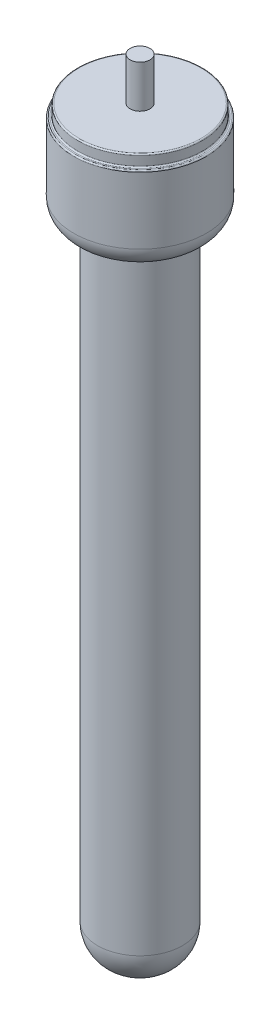
from build123d import *

# Parameters (mm, degrees)
SKETCH1_R           = 12.5
BOSS_EXTRUDE1_DEPTH = 148.5
SKETCH2_OUTSIDE_W   = 57.53
SKETCH2_OUTSIDE_H   = 57.53
SKETCH2_OUTSIDE_R   = 8
CUT_EXTRUDE1_DEPTH  = 121.5
SKETCH3_OUTSIDE_W   = 57.53
SKETCH3_OUTSIDE_H   = 57.53
SKETCH3_OUTSIDE_R   = 1.875
CUT_EXTRUDE2_DEPTH  = 8
FILLET1_R           = 4
FILLET2_R           = 7
SKETCH6_OUTSIDE_W   = 57.53
SKETCH6_OUTSIDE_H   = 57.53
SKETCH6_OUTSIDE_R   = 11.75
CUT_EXTRUDE3_DEPTH  = 2.2
FILLET3_R           = 0.25


with BuildPart() as part:
    # Sketch1 → Boss-Extrude1 (new body)
    with BuildSketch(Plane(origin=(0, 0, 0), x_dir=(1, 0, 0), z_dir=(0, 1, 0))):
        with Locations(Location((0, 0, 0), (0, 0, 270))):
            Circle(SKETCH1_R)
    extrude(amount=BOSS_EXTRUDE1_DEPTH)

    # Sketch2 outside → Cut-Extrude1 (cut)
    with BuildSketch(Plane.XZ):
        Rectangle(SKETCH2_OUTSIDE_W, SKETCH2_OUTSIDE_H)
        with Locations(Location((0, 0, 0), (0, 0, 270))):
            Circle(SKETCH2_OUTSIDE_R, mode=Mode.SUBTRACT)
    extrude(amount=-CUT_EXTRUDE1_DEPTH, mode=Mode.SUBTRACT)

    # Sketch3 outside → Cut-Extrude2 (cut)
    with BuildSketch(Plane(origin=(0, 148.5, 0), x_dir=(1, 0, 0), z_dir=(0, 1, 0))):
        Rectangle(SKETCH3_OUTSIDE_W, SKETCH3_OUTSIDE_H)
        with Locations(Location((0, 0, 0), (0, 0, 270))):
            Circle(SKETCH3_OUTSIDE_R, mode=Mode.SUBTRACT)
    extrude(amount=-CUT_EXTRUDE2_DEPTH, mode=Mode.SUBTRACT)

    # Fillet1
    fillet1_edges = [part.edges().sort_by_distance(p)[0] for p in [
        (0, 121.5, -12.5),
    ]]
    fillet(fillet1_edges, radius=FILLET1_R)

    # Fillet2
    fillet2_edges = [part.edges().sort_by_distance(p)[0] for p in [
        (0, 0, 8),
    ]]
    fillet(fillet2_edges, radius=FILLET2_R)

    # Sketch6 outside → Cut-Extrude3 (cut)
    with BuildSketch(Plane(origin=(0, 140.5, 0), x_dir=(1, 0, 0), z_dir=(0, 1, 0))):
        Rectangle(SKETCH6_OUTSIDE_W, SKETCH6_OUTSIDE_H)
        with Locations(Location((0, 0, 0), (0, 0, 270))):
            Circle(SKETCH6_OUTSIDE_R, mode=Mode.SUBTRACT)
    extrude(amount=-CUT_EXTRUDE3_DEPTH, mode=Mode.SUBTRACT)

    # Fillet3
    fillet3_edges = [part.edges().sort_by_distance(p)[0] for p in [
        (0, 138.3, -11.75),
        (0, 138.3, -12.5),
        (0, 140.5, -11.75),
    ]]
    fillet(fillet3_edges, radius=FILLET3_R)


solid = part.part
